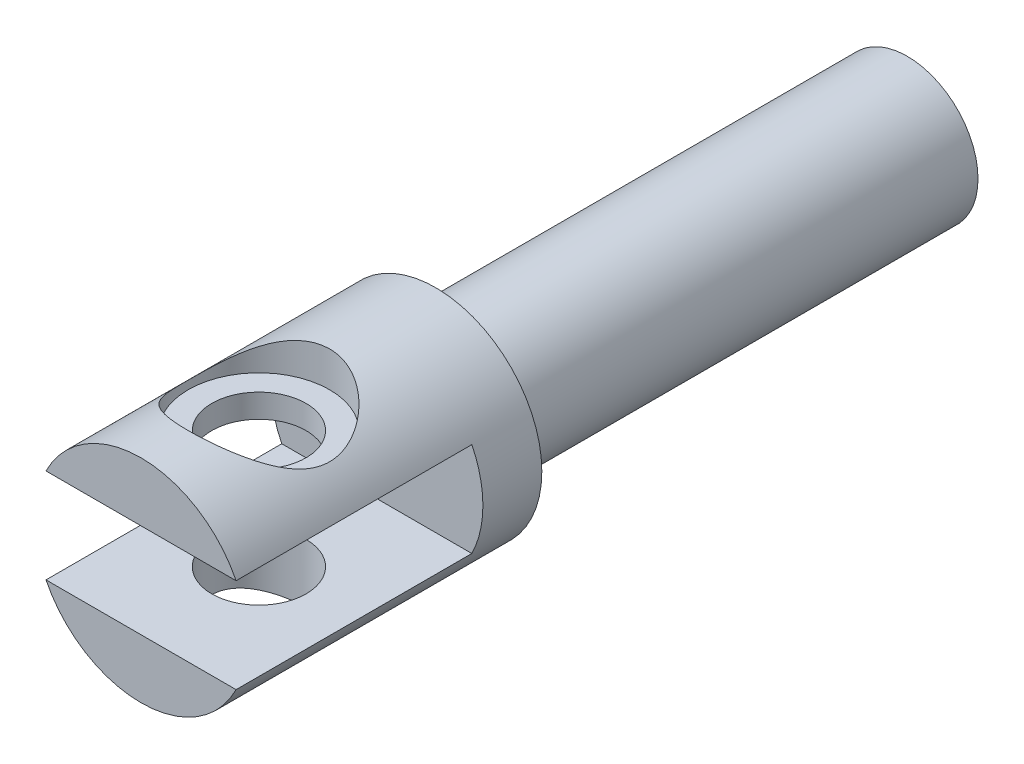
from build123d import *

# Parameters (mm, degrees)
SZKIC2_W                        = 18
SZKIC2_H                        = 8
WYTNIJ_WYCI_GNI_CIE1_DEPTH      = 20
WYTNIJ_WYCI_GNI_CIE2_DEPTH      = 42.976183724
WYTNIJ_WYCI_GNI_CIE2_DEPTH_BACK = 42.976183724
SZKIC3_R                        = 4
WYTNIJ_WYCI_GNI_CIE3_START      = 6
SZKIC3_4_R                      = 6
SZKIC3_4_R_2                    = 4
WYTNIJ_WYCI_GNI_CIE3_DEPTH      = 36.976183767


with BuildPart() as part:
    # Szkic1 → Obrót1 (revolve)
    with BuildSketch(Plane(origin=(0, 0, 0), x_dir=(1, 0, 0), z_dir=(0, 1, 0))):
        Polygon((0, -25), (9, -25), (9, 0), (6, 0), (6, 40), (0, 40), align=None)
    revolve(axis=Axis((0, 0, 44.409951059), (0, 0, -1)))

    # Szkic2 → Wytnij-wyciągnięcie1 (cut)
    with BuildSketch(Plane.XY.offset(25)):
        Rectangle(SZKIC2_W, SZKIC2_H)
    extrude(amount=-WYTNIJ_WYCI_GNI_CIE1_DEPTH, mode=Mode.SUBTRACT)

    # Szkic3 → Wytnij-wyciągnięcie2 (cut, two sides: drawn at the far end of the back side and taken through both)
    with BuildSketch(Plane(origin=(0, 0, 0), x_dir=(1, 0, 0), z_dir=(0, 1, 0)).offset(-WYTNIJ_WYCI_GNI_CIE2_DEPTH_BACK)):
        with Locations((0, -15)):
            Circle(SZKIC3_R)
    extrude(amount=WYTNIJ_WYCI_GNI_CIE2_DEPTH + WYTNIJ_WYCI_GNI_CIE2_DEPTH_BACK, mode=Mode.SUBTRACT)

    # Szkic3<4> → Wytnij-wyciągnięcie3 (cut, through all)
    with BuildSketch(Plane(origin=(0, 0, 0), x_dir=(1, 0, 0), z_dir=(0, 1, 0)).offset(WYTNIJ_WYCI_GNI_CIE3_START)):
        with Locations((0, -15)):
            Circle(SZKIC3_4_R)
        with Locations((0, -15)):
            Circle(SZKIC3_4_R_2, mode=Mode.SUBTRACT)
    extrude(amount=WYTNIJ_WYCI_GNI_CIE3_DEPTH, mode=Mode.SUBTRACT)


solid = part.part
